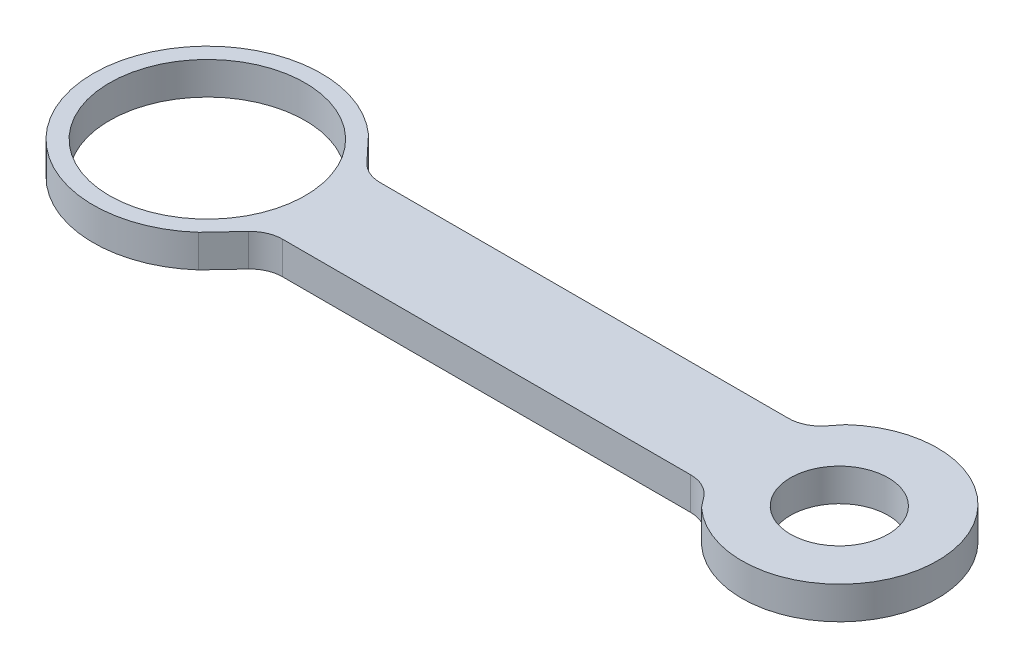
from build123d import *

# Parameters (mm, degrees)
SKETCH1_R           = 0.605786837
BOSS_EXTRUDE1_DEPTH = 10
SKETCH3_R           = 30
SKETCH3_R_2         = 15
CUT_EXTRUDE1_DEPTH  = 10


with BuildPart() as part:
    # Sketch1 → Boss-Extrude1 (new body)
    with BuildSketch(Plane(origin=(0, 0, 0), x_dir=(1, 0, 0), z_dir=(0, 1, 0))):
        with BuildLine():
            Line((42.395388783, 14.504200511), (45.014187909, 17.812893064))
            ThreePointArc((45.014187909, 17.812893064), (95.299132477, -4.289618646), (45.014187909, -26.392130356))
            Line((45.014187909, -26.392130356), (42.395388783, -23.083437803))
            ThreePointArc((42.395388783, -23.083437803), (38.909611349, -20.287901909), (34.554258804, -19.289618646))
            Line((34.554258804, -19.289618646), (-90.607383501, -19.289618646))
            ThreePointArc((-90.607383501, -19.289618646), (-94.579180908, -20.112210224), (-97.897544897, -22.444653576))
            Line((-97.897544897, -22.444653576), (-105.310368622, -30.339607137))
            ThreePointArc((-105.310368622, -30.339607137), (-163.685528507, -4.289618646), (-105.310368622, 21.760369845))
            Line((-105.310368622, 21.760369845), (-97.897544897, 13.865416283))
            ThreePointArc((-97.897544897, 13.865416283), (-94.579180908, 11.532972931), (-90.607383501, 10.710381354))
            Line((-90.607383501, 10.710381354), (34.554258804, 10.710381354))
            ThreePointArc((34.554258804, 10.710381354), (38.909611349, 11.708664617), (42.395388783, 14.504200511))
        make_face()
        with Locations(Location((65.299132477, -4.289618646, 0), (0, 0, 270))):
            Circle(SKETCH1_R, mode=Mode.SUBTRACT)
    extrude(amount=BOSS_EXTRUDE1_DEPTH)

    # Sketch3 → Cut-Extrude1 (cut)
    with BuildSketch(Plane(origin=(0, 10, 0), x_dir=(1, 0, 0), z_dir=(0, 1, 0))):
        with Locations(Location((-128.685528507, -4.289618646, 0), (0, 0, 270))):
            Circle(SKETCH3_R)
        with Locations(Location((65.664200703, -4.773046906, 0), (0, 0, 270))):
            Circle(SKETCH3_R_2)
    extrude(amount=-CUT_EXTRUDE1_DEPTH, mode=Mode.SUBTRACT)


solid = part.part
